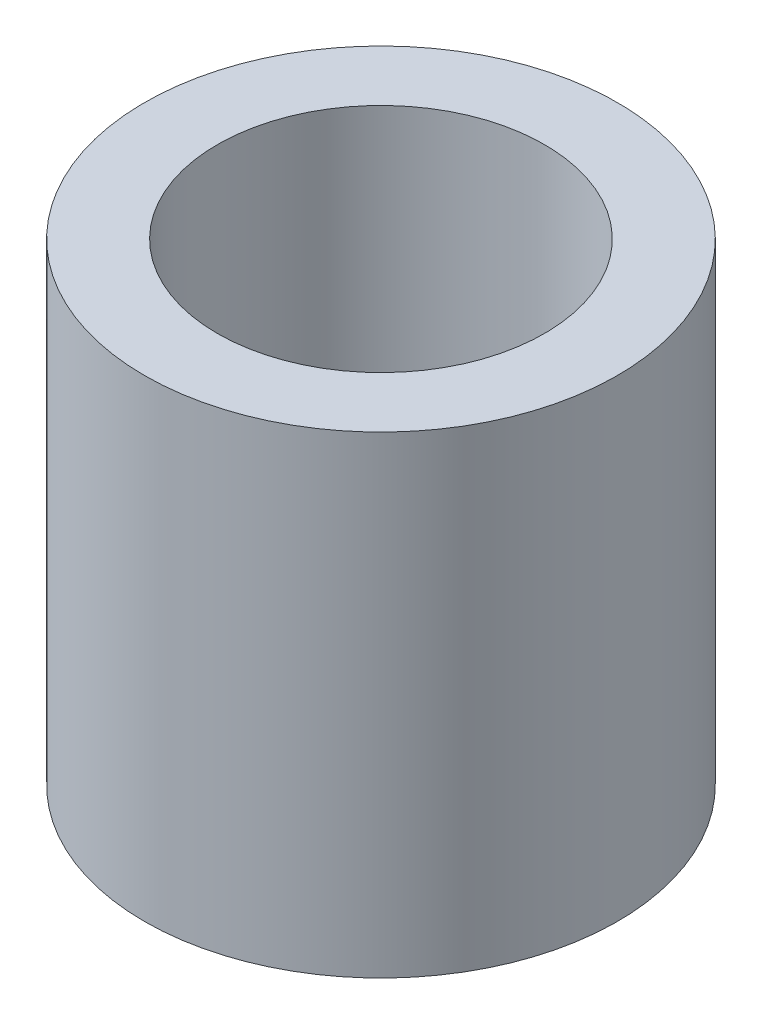
from build123d import *

# Parameters (mm, degrees)
SKETCH1_R           = 25
SKETCH1_R_2         = 17.3
BOSS_EXTRUDE1_DEPTH = 50


with BuildPart() as part:
    # Sketch1 → Boss-Extrude1 (new body)
    with BuildSketch(Plane(origin=(0, 0, 0), x_dir=(1, 0, 0), z_dir=(0, 1, 0))):
        with Locations(Location((0, 0, 0), (0, 0, 270))):
            Circle(SKETCH1_R)
        with Locations(Location((0, 0, 0), (0, 0, 270))):
            Circle(SKETCH1_R_2, mode=Mode.SUBTRACT)
    extrude(amount=BOSS_EXTRUDE1_DEPTH)


solid = part.part
